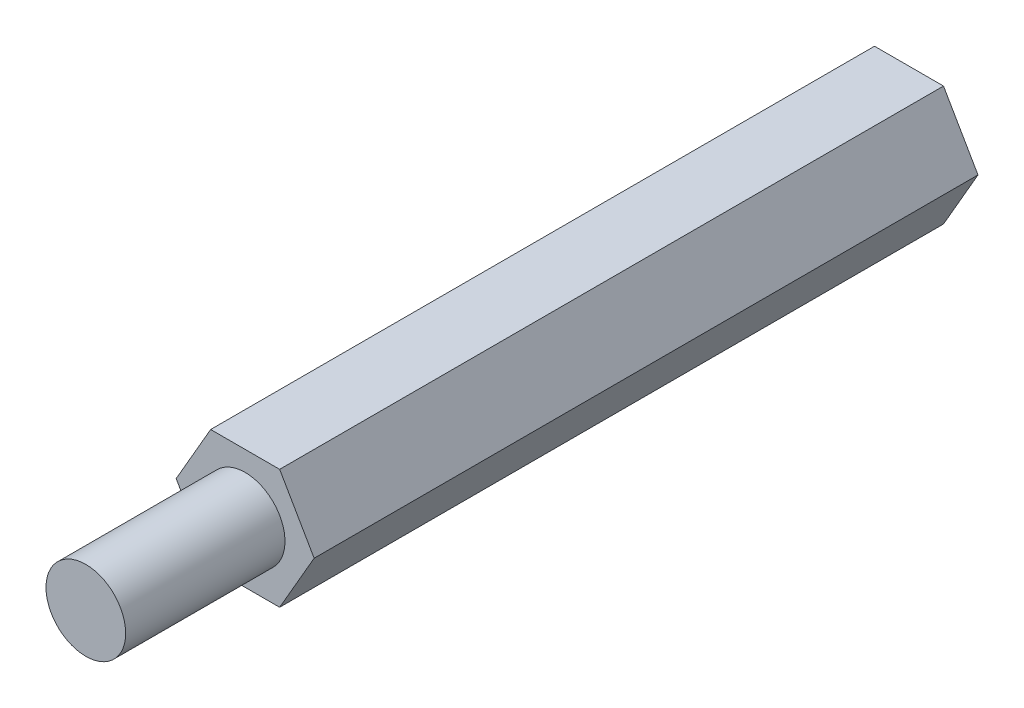
from build123d import *

# Parameters (mm, degrees)
SKETCH1_R           = 1.5
BOSS_EXTRUDE1_DEPTH = 6
BOSS_EXTRUDE2_DEPTH = 25
SKETCH3_R           = 1.5
CUT_EXTRUDE1_DEPTH  = 4.5


with BuildPart() as part:
    # Sketch1 → Boss-Extrude1 (new body)
    with BuildSketch(Plane.XY):
        Circle(SKETCH1_R)
    extrude(amount=BOSS_EXTRUDE1_DEPTH)

    # Sketch2 → Boss-Extrude2 (add)
    with BuildSketch(Plane(origin=(0, 0, 0), x_dir=(-1, 0, 0), z_dir=(0, 0, -1))):
        Polygon((-1.299038106, 2.25), (-2.598076211, 0), (-1.299038106, -2.25), (1.299038106, -2.25), (2.598076211, 0), (1.299038106, 2.25), align=None)
    extrude(amount=BOSS_EXTRUDE2_DEPTH)

    # Sketch3 → Cut-Extrude1 (cut)
    with BuildSketch(Plane(origin=(0, 0, -25), x_dir=(-1, 0, 0), z_dir=(0, 0, -1))):
        Circle(SKETCH3_R)
    extrude(amount=-CUT_EXTRUDE1_DEPTH, mode=Mode.SUBTRACT)


solid = part.part
